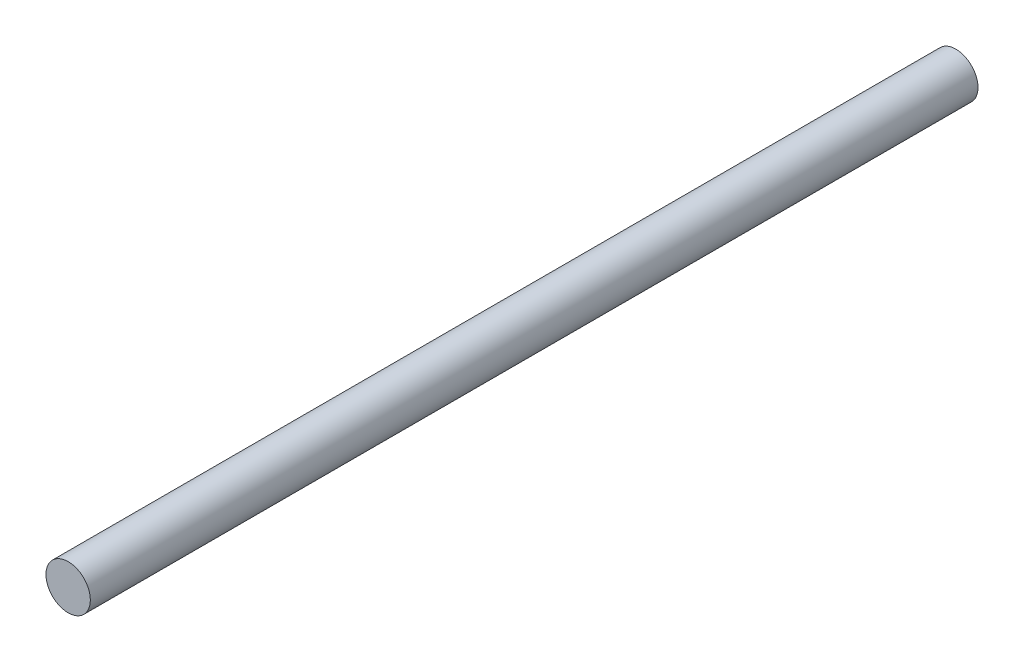
from build123d import *

# Parameters (mm, degrees)
SKETCH1_R           = 3
BOSS_EXTRUDE1_DEPTH = 120


with BuildPart() as part:
    # Sketch1 → Boss-Extrude1 (new body)
    with BuildSketch(Plane.XY):
        Circle(SKETCH1_R)
    extrude(amount=BOSS_EXTRUDE1_DEPTH)


solid = part.part
